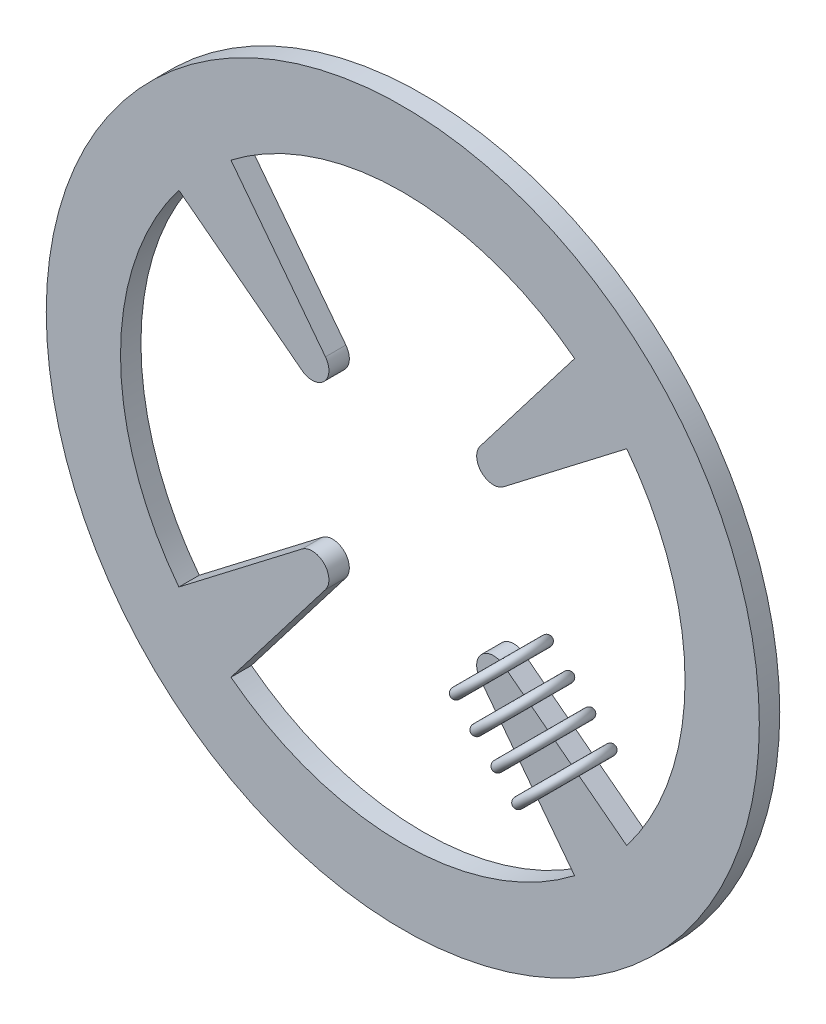
from build123d import *

# Parameters (mm, degrees)
SKETCH_1_R      = 0.96
SKETCH_1_R_2    = 0.76
EXTRUDE_1_DEPTH = 0.055
EXTRUDE_START   = -0.055
EXTRUDE_2_DEPTH = 0.055
SKETCH_73_R     = 0.0132
SKETCH_82_R     = 0.0132
SKETCH_84_R     = 0.0132
SKETCH_86_R     = 0.0132


with BuildPart() as part:
    # 草圖1 → 填料-伸長1 (new body)
    with BuildSketch(Plane.XY):
        Circle(SKETCH_1_R)
        Circle(SKETCH_1_R_2, mode=Mode.SUBTRACT)
    extrude(amount=EXTRUDE_1_DEPTH)

    # 草圖2 → 填料-伸長2 (add)
    with BuildSketch(Plane.XY.offset(0.055).offset(EXTRUDE_START)):
        with BuildLine():
            Line((-0.208247811, 0.271393831), (-0.462658686, 0.602948539))
            ThreePointArc((-0.462658686, 0.602948539), (-0.537401154, 0.537401154), (-0.602948539, 0.462658686))
            Line((-0.602948539, 0.462658686), (-0.271393831, 0.208247811))
            ThreePointArc((-0.271393831, 0.208247811), (-0.241031974, 0.199037642), (-0.212132034, 0.212132034))
            ThreePointArc((-0.212132034, 0.212132034), (-0.199037642, 0.241031974), (-0.208247811, 0.271393831))
        make_face()
        with BuildLine():
            ThreePointArc((0.208247811, 0.271393831), (0.199037642, 0.241031974), (0.212132034, 0.212132034))
            ThreePointArc((0.212132034, 0.212132034), (0.241031974, 0.199037642), (0.271393831, 0.208247811))
            Line((0.271393831, 0.208247811), (0.602948539, 0.462658686))
            ThreePointArc((0.602948539, 0.462658686), (0.537401154, 0.537401154), (0.462658686, 0.602948539))
            Line((0.462658686, 0.602948539), (0.208247811, 0.271393831))
        make_face()
        with BuildLine():
            ThreePointArc((0.271393831, -0.208247811), (0.241031974, -0.199037642), (0.212132034, -0.212132034))
            ThreePointArc((0.212132034, -0.212132034), (0.199037642, -0.241031974), (0.208247811, -0.271393831))
            Line((0.208247811, -0.271393831), (0.462658686, -0.602948539))
            ThreePointArc((0.462658686, -0.602948539), (0.537401154, -0.537401154), (0.602948539, -0.462658686))
            Line((0.602948539, -0.462658686), (0.271393831, -0.208247811))
        make_face()
        with BuildLine():
            ThreePointArc((-0.208247811, -0.271393831), (-0.199037642, -0.241031974), (-0.212132034, -0.212132034))
            ThreePointArc((-0.212132034, -0.212132034), (-0.241031974, -0.199037642), (-0.271393831, -0.208247811))
            Line((-0.271393831, -0.208247811), (-0.602948539, -0.462658686))
            ThreePointArc((-0.602948539, -0.462658686), (-0.537401154, -0.537401154), (-0.462658686, -0.602948539))
            Line((-0.462658686, -0.602948539), (-0.208247811, -0.271393831))
        make_face()
    extrude(amount=EXTRUDE_2_DEPTH)


with BuildPart() as body_2:
    # 掃出2: sweep along a path in 草圖72
    with BuildLine(Plane(origin=(0.353553391, -0.353553391, 0), x_dir=(0, 0, -1), z_dir=(0.7071067811865487, -0.7071067811865464, 0))) as sweep_2_path:
        CenterArc((-0.03, 0), 0.1, 0, 360)
    # 草圖73 → 掃出2 (sweep)
    with BuildSketch(Plane(origin=(0.424264069, -0.282842712, 0.03), x_dir=(1, 0, 0), z_dir=(0, 0, 1))):
        Circle(SKETCH_73_R)
    sweep(path=sweep_2_path.line)


with BuildPart() as body_3:
    # 掃出3: sweep along a path in 草圖77
    with BuildLine(Plane(origin=(0.240416306, -0.240416306, 0), x_dir=(0.7071067811865477, 0.7071067811865475, 0), z_dir=(0.7071067811865475, -0.7071067811865477, 0))) as sweep_3_path:
        CenterArc((0, 0.03), 0.1, 0, 360)
    # 草圖82 → 掃出3 (sweep)
    with BuildSketch(Plane(origin=(0.308328718, -0.172503894, 0.055), x_dir=(0.9840078796117616, -0.032244145112418646, 0.17518221361751976), z_dir=(-0.17812493610375005, -0.17812493610374996, 0.9677515250703923))):
        Circle(SKETCH_82_R)
    sweep(path=sweep_3_path.line)


with BuildPart() as body_4:
    # 掃出4: sweep along a path in 草圖83
    with BuildLine(Plane(origin=(0.296984848, -0.296984848, 0), x_dir=(0, 0, -1), z_dir=(0.7071067811865487, -0.7071067811865464, 0))) as sweep_4_path:
        CenterArc((-0.03, 0), 0.1, 0, 360)
    # 草圖84 → 掃出4 (sweep)
    with BuildSketch(Plane(origin=(0.367695526, -0.22627417, 0.03), x_dir=(1, 0, 0), z_dir=(0, 0, 1))):
        Circle(SKETCH_84_R)
    sweep(path=sweep_4_path.line)


with BuildPart() as body_5:
    # 掃出5: sweep along a path in 草圖85
    with BuildLine(Plane(origin=(0.410121933, -0.410121933, 0), x_dir=(0, 0, -1), z_dir=(0.7071067811865487, -0.7071067811865464, 0))) as sweep_5_path:
        CenterArc((-0.03, 0), 0.100656985, 0, 360)
    # 草圖86 → 掃出5 (sweep)
    with BuildSketch(Plane(origin=(0.424264069, -0.282842712, 0.03), x_dir=(1, 0, 0), z_dir=(0, 0, 1))):
        with Locations((0.057033101, -0.056103984)):
            Circle(SKETCH_86_R)
    sweep(path=sweep_5_path.line)


solid = Compound([part.part, body_2.part, body_3.part, body_4.part, body_5.part])
